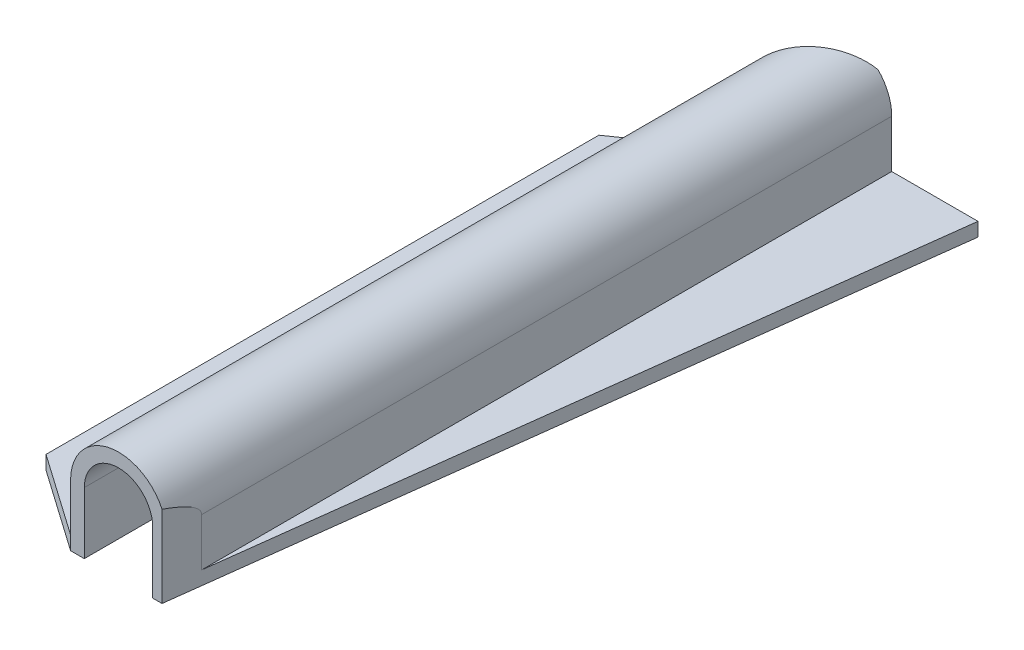
from build123d import *

# Parameters (mm, degrees)
EXTRU_MINCE1_DEPTH      = 53
ENL_V_MAT_EXTRU_1_DEPTH = 57.384838388
ESQUISSE3_R             = 1.1
ENL_V_MAT_EXTRU_2_DEPTH = 55.351611691


with BuildPart() as part:
    # Esquisse1 → Extru.-Mince1 (new body)
    with BuildSketch(Plane.XY):
        with BuildLine():
            Line((-9.5, 0), (-2.5, 0))
            Line((-2.5, 0), (-2.5, 4.5))
            ThreePointArc((-2.5, 4.5), (0, 7), (2.5, 4.5))
            Line((2.5, 4.5), (2.5, 0))
            Line((2.5, 0), (17.5, 0))
            Line((17.5, 0), (17.5, 1))
            Line((17.5, 1), (3.5, 1))
            Line((3.5, 1), (3.5, 4.5))
            ThreePointArc((3.5, 4.5), (0, 8), (-3.5, 4.5))
            Line((-3.5, 4.5), (-3.5, 1))
            Line((-3.5, 1), (-9.5, 1))
            Line((-9.5, 1), (-9.5, 0))
        make_face()
    extrude(amount=EXTRU_MINCE1_DEPTH)

    # Esquisse2 → Enlèv. mat.-Extru.1 (cut, through all)
    with BuildSketch(Plane(origin=(0, 0, 0), x_dir=(1, 0, 0), z_dir=(0, 1, 0))):
        Polygon((2.5, 0), (-9.5, -8.402490459), (-9.5, 0), align=None)
        Polygon((17.5, -53), (17.5, 61.57469904), (3.177754145, -53), align=None)
        Polygon((-9.5, -48.798754771), (-9.5, -53), (-3.5, -53), align=None)
    extrude(amount=ENL_V_MAT_EXTRU_1_DEPTH, mode=Mode.SUBTRACT)

    # Esquisse3 → Enlèv. mat.-Extru.2 (cut, through all)
    with BuildSketch(Plane(origin=(0, 1, 0), x_dir=(1, 0, 0), z_dir=(0, 1, 0))):
        with Locations(Location((-7, -28.600622615, 0), (0, 0, 270))):
            Circle(ESQUISSE3_R)
    extrude(amount=-ENL_V_MAT_EXTRU_2_DEPTH, mode=Mode.SUBTRACT)


solid = part.part
